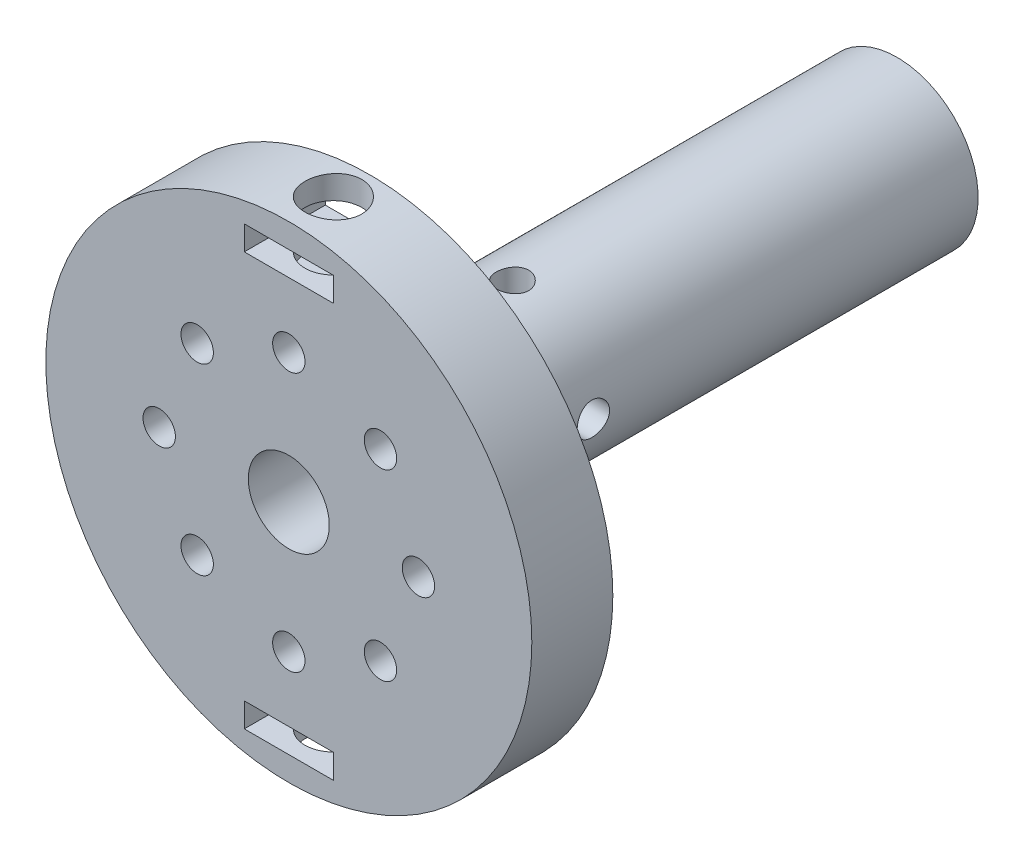
from build123d import *

# Parameters (mm, degrees)
SKETCH1_R               = 30
BOSS_EXTRUDE1_DEPTH     = 10
SKETCH2_R               = 10
BOSS_EXTRUDE2_DEPTH     = 65.1
SKETCH2_2_R             = 10
BOSS_EXTRUDE3_DEPTH     = 20
SKETCH5_R               = 5
CUT_EXTRUDE1_DEPTH      = 87.255492579
SKETCH6_R               = 2
CUT_EXTRUDE2_DEPTH      = 78.704633067
CIRPATTERN1_COUNT       = 2
CIRPATTERN1_ANGLE       = 90
CUT_EXTRUDE3_DEPTH      = 87.255492666
CUT_EXTRUDE3_DEPTH_BACK = 87.255492666
SKETCH7_R               = 2
SKETCH9_W               = 11
SKETCH9_H               = 3
CUT_EXTRUDE5_DEPTH      = 10
SKETCH10_R              = 3.5
CUT_EXTRUDE6_DEPTH      = 8
SKETCH17_R              = 7.355644599
BOSS_EXTRUDE4_DEPTH     = 25
SKETCH18_R              = 3
CUT_EXTRUDE7_DEPTH      = 15
BOSS_EXTRUDE5_START     = 10
BOSS_EXTRUDE5_DEPTH     = 10


with BuildPart() as part:
    # Sketch1 → Boss-Extrude1 (new body)
    with BuildSketch(Plane.XY):
        Circle(SKETCH1_R)
    extrude(amount=BOSS_EXTRUDE1_DEPTH)

    # Sketch2 → Boss-Extrude2 (add)
    with BuildSketch(Plane(origin=(0, 0, 0), x_dir=(-1, 0, 0), z_dir=(0, 0, -1))):
        Circle(SKETCH2_R)
    extrude(amount=BOSS_EXTRUDE2_DEPTH)

    # Sketch2<2> → Boss-Extrude3 (add)
    with BuildSketch(Plane(origin=(0, 0, 0), x_dir=(-1, 0, 0), z_dir=(0, 0, -1))):
        Circle(SKETCH2_2_R)
    extrude(amount=BOSS_EXTRUDE3_DEPTH)

    # Sketch5 → Cut-Extrude1 (cut, through all)
    with BuildSketch(Plane(origin=(0, 0, -65.1), x_dir=(-1, 0, 0), z_dir=(0, 0, -1))):
        Circle(SKETCH5_R)
    extrude(amount=-CUT_EXTRUDE1_DEPTH, mode=Mode.SUBTRACT)

    # Sketch6 → Cut-Extrude2 (cut, symmetric)
    with BuildSketch(Plane(origin=(0, 0, 0), x_dir=(1, 0, 0), z_dir=(0, 1, 0))):
        with Locations((0, 17.6)):
            Circle(SKETCH6_R)
    cut_extrude2 = extrude(amount=CUT_EXTRUDE2_DEPTH, both=True, mode=Mode.SUBTRACT)

    # CirPattern1: Cut-Extrude2 ×2 about axis
    cirpattern1_axis = Axis((0, 0, -65.1), (0, 0, 1))
    for i in range(1, CIRPATTERN1_COUNT):
        add(cut_extrude2.rotate(cirpattern1_axis, i * CIRPATTERN1_ANGLE / (CIRPATTERN1_COUNT - 1)), mode=Mode.SUBTRACT)

    # Sketch7 → Cut-Extrude3 (cut, two sides: drawn at the far end of the back side and taken through both)
    with BuildSketch(Plane.XY.offset(10).offset(-CUT_EXTRUDE3_DEPTH_BACK)):
        with Locations((0, 16)):
            Circle(SKETCH7_R)
        with Locations((11.313708499, 11.313708499)):
            Circle(SKETCH7_R)
        with Locations((16, 0)):
            Circle(SKETCH7_R)
        with Locations((11.313708499, -11.313708499)):
            Circle(SKETCH7_R)
        with Locations((0, -16)):
            Circle(SKETCH7_R)
        with Locations((-11.313708499, -11.313708499)):
            Circle(SKETCH7_R)
        with Locations((-16, 0)):
            Circle(SKETCH7_R)
        with Locations((-11.313708499, 11.313708499)):
            Circle(SKETCH7_R)
    extrude(amount=CUT_EXTRUDE3_DEPTH + CUT_EXTRUDE3_DEPTH_BACK, mode=Mode.SUBTRACT)

    # Sketch9 → Cut-Extrude5 (cut)
    with BuildSketch(Plane(origin=(0, 0, 0), x_dir=(-1, 0, 0), z_dir=(0, 0, -1))):
        with Locations((0, 25.5)):
            Rectangle(SKETCH9_W, SKETCH9_H)
    cut_extrude5 = extrude(amount=-CUT_EXTRUDE5_DEPTH, mode=Mode.SUBTRACT)

    # Mirror1: Cut-Extrude5 across plane
    add(cut_extrude5.mirror(Plane.ZX), mode=Mode.SUBTRACT)

    # Sketch10 → Cut-Extrude6 (cut)
    with BuildSketch(Plane(origin=(0, -30, 0), x_dir=(-1, 0, 0), z_dir=(0, -1, 0))):
        with Locations((0, -4.5)):
            Circle(SKETCH10_R)
    cut_extrude6 = extrude(amount=-CUT_EXTRUDE6_DEPTH, mode=Mode.SUBTRACT)

    # Mirror2: Cut-Extrude6 across plane
    add(cut_extrude6.mirror(Plane.ZX), mode=Mode.SUBTRACT)

    # Sketch17 → Boss-Extrude4 (add)
    with BuildSketch(Plane(origin=(0, 0, -40.1), x_dir=(-1, 0, 0), z_dir=(0, 0, -1))):
        Circle(SKETCH17_R)
    extrude(amount=BOSS_EXTRUDE4_DEPTH)

    # Sketch18 → Cut-Extrude7 (cut)
    with BuildSketch(Plane(origin=(0, 0, -65.1), x_dir=(-1, 0, 0), z_dir=(0, 0, -1))):
        Circle(SKETCH18_R)
    extrude(amount=-CUT_EXTRUDE7_DEPTH, mode=Mode.SUBTRACT)

    # Sketch19 → Boss-Extrude5 (add)
    with BuildSketch(Plane(origin=(0, 0, -50.1), x_dir=(-1, 0, 0), z_dir=(0, 0, -1)).offset(BOSS_EXTRUDE5_START)):
        with BuildLine():
            Line((1.658312395, 2.5), (-1.658312395, 2.5))
            ThreePointArc((-1.658312395, 2.5), (0, 3), (1.658312395, 2.5))
        make_face()
    extrude(amount=-BOSS_EXTRUDE5_DEPTH)


solid = part.part
